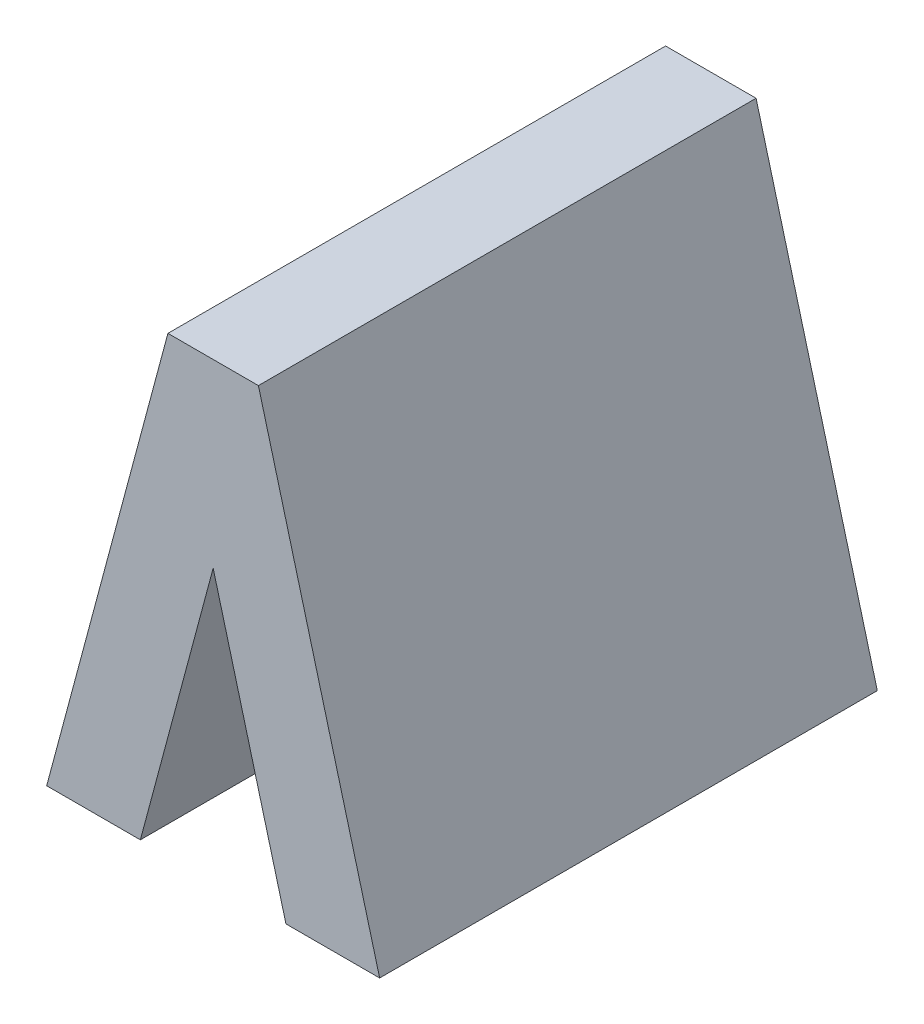
from build123d import *

# Parameters (mm, degrees)
SALIENTE_EXTRUIR1_DEPTH = 110


with BuildPart() as part:
    # Croquis1 → Saliente-Extruir1 (new body)
    with BuildSketch(Plane.XY):
        Polygon((-0.373633898, 0), (-27.168553141, -100), (-6.463029533, -100), (9.626366102, -39.953558027), (25.715761737, -100), (46.421285345, -100), (19.626366102, 0), align=None)
    extrude(amount=SALIENTE_EXTRUIR1_DEPTH)


solid = part.part
